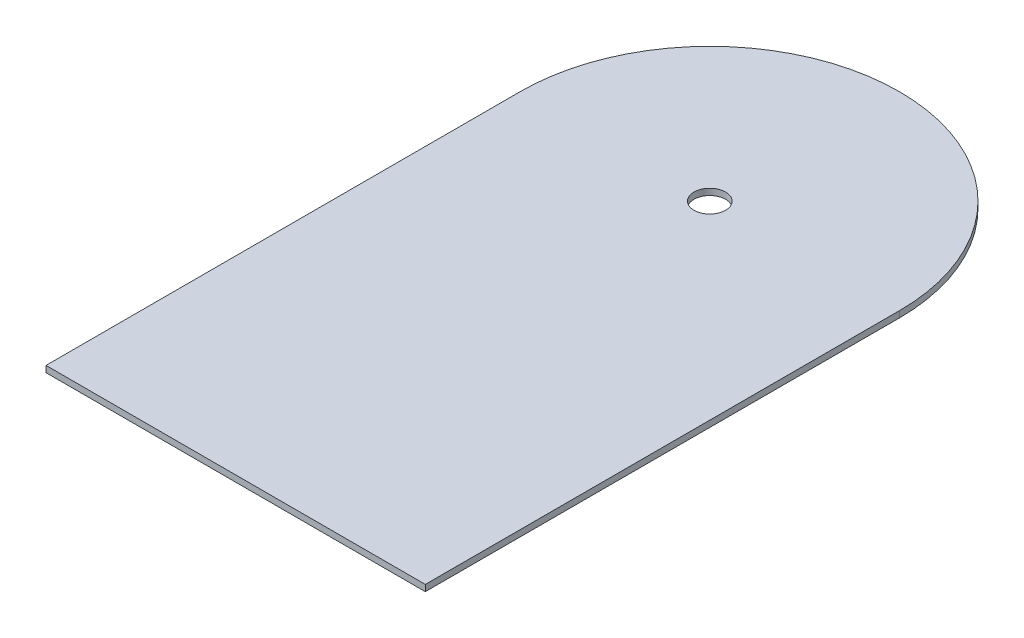
from build123d import *

# Parameters (mm, degrees)
SCHIZZO1_R                   = 2.5
ESTRUSIONE_ESTRUSIONE1_DEPTH = 1


with BuildPart() as part:
    # Schizzo1 → Estrusione-Estrusione1 (new body)
    with BuildSketch(Plane(origin=(0, 9.820560966, 0), x_dir=(1, 0, 0), z_dir=(0, 1, 0))):
        with BuildLine():
            Line((-30, 0), (-30, -75))
            Line((-30, -75), (30, -75))
            Line((30, -75), (30, 0))
            ThreePointArc((30, 0), (0, 30), (-30, 0))
        make_face()
        with Locations(Location((0, 0, 0), (0, 0, 180))):
            Circle(SCHIZZO1_R, mode=Mode.SUBTRACT)
    extrude(amount=ESTRUSIONE_ESTRUSIONE1_DEPTH)


solid = part.part
